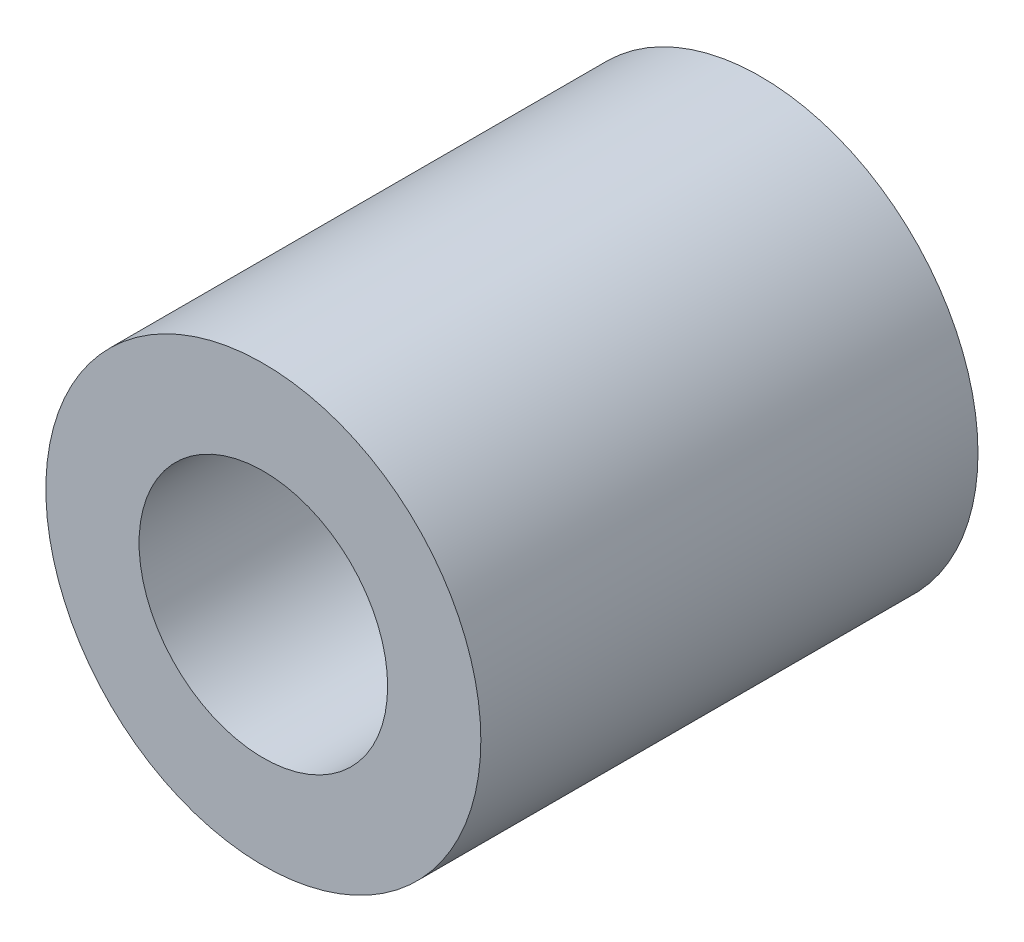
from build123d import *

# Parameters (mm, degrees)
SKETCH1_R           = 11.1125
SKETCH1_R_2         = 6.35
BOSS_EXTRUDE1_DEPTH = 12.7


with BuildPart() as part:
    # Sketch1 → Boss-Extrude1 (new, symmetric)
    with BuildSketch(Plane.XY):
        Circle(SKETCH1_R)
        Circle(SKETCH1_R_2, mode=Mode.SUBTRACT)
    extrude(amount=BOSS_EXTRUDE1_DEPTH, both=True)


solid = part.part
